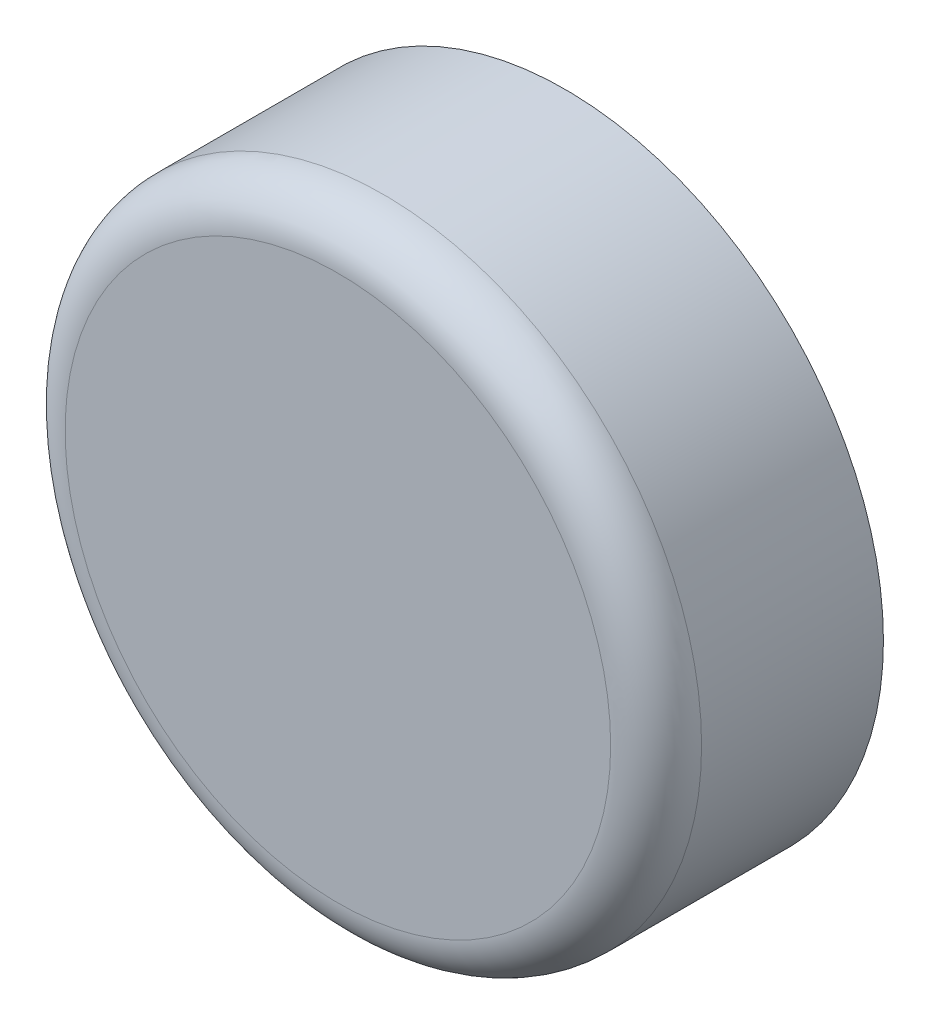
from build123d import *

# Parameters (mm, degrees)
SKIZZE1_R                       = 14
AUFSATZ_LINEAR_AUSTRAGEN1_DEPTH = 10
VERRUNDUNG1_R                   = 2


with BuildPart() as part:
    # Skizze1 → Aufsatz-Linear austragen1 (new body)
    with BuildSketch(Plane.XY):
        Circle(SKIZZE1_R)
    extrude(amount=AUFSATZ_LINEAR_AUSTRAGEN1_DEPTH)

    # Verrundung1
    verrundung1_edges = [part.edges().sort_by_distance(p)[0] for p in [
        (-14, 0, 10),
    ]]
    fillet(verrundung1_edges, radius=VERRUNDUNG1_R)


solid = part.part
